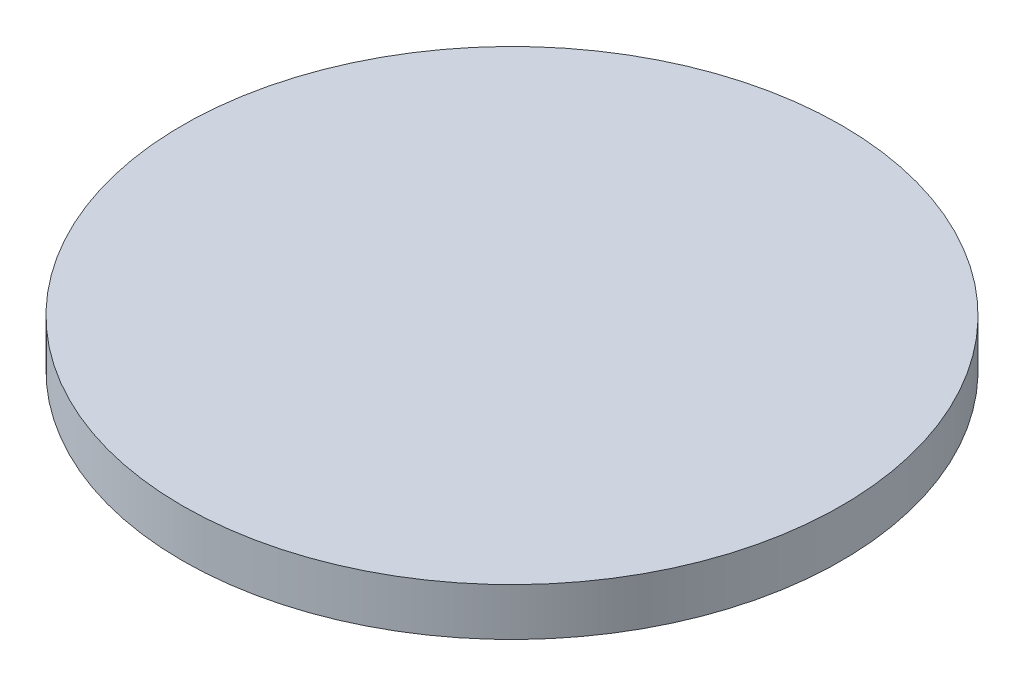
from build123d import *

# Parameters (mm, degrees)
SKETCH1_R           = 12.1285
BOSS_EXTRUDE1_DEPTH = 1.75


with BuildPart() as part:
    # Sketch1 → Boss-Extrude1 (new body)
    with BuildSketch(Plane(origin=(0, 0, 0), x_dir=(1, 0, 0), z_dir=(0, 1, 0))):
        with Locations(Location((0, 0, 0), (0, 0, 270))):
            Circle(SKETCH1_R)
    extrude(amount=BOSS_EXTRUDE1_DEPTH)


solid = part.part
